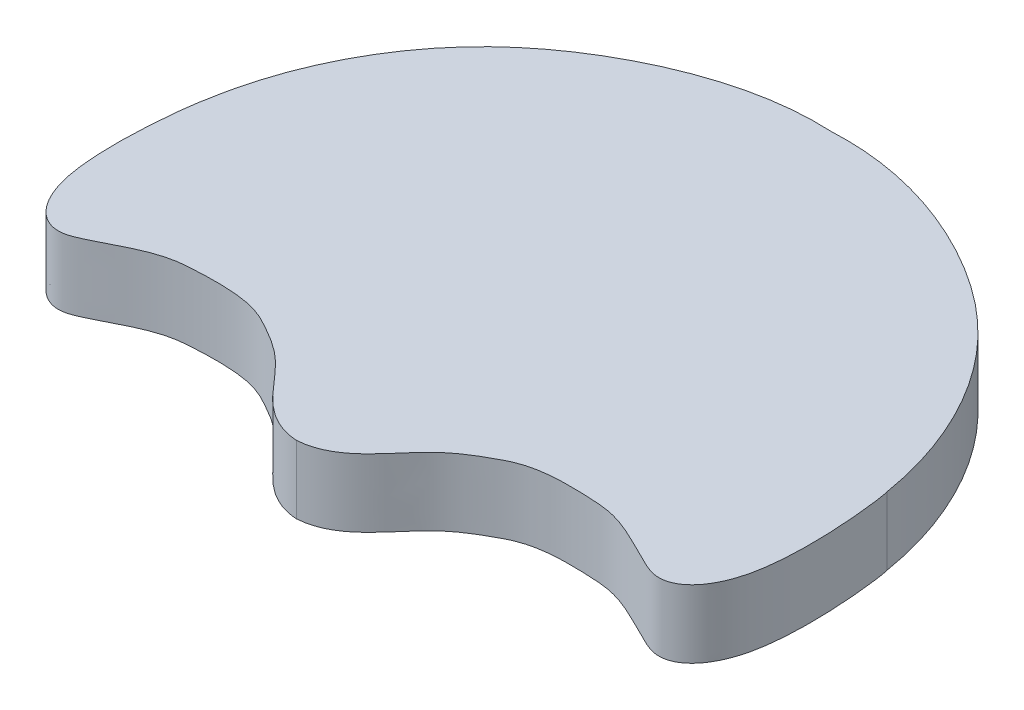
from build123d import *

# Parameters (mm, degrees)
BOSS_EXTRUDE1_DEPTH = 38.1


with BuildPart() as part:
    # Sketch3 → Boss-Extrude1 (new body)
    with BuildSketch(Plane(origin=(0, 0, 0), x_dir=(1, 0, 0), z_dir=(0, 1, 0))):
        with BuildLine():
            add(Edge.make_bspline(
                [(-190.5, 0), (-184.392726562, 37.537038237), (-157.261289847, 93.964093485), (-82.387478202, 146.622658841), (-31.311374143, 160.799884185), (0, 159.189909928)],
                knots=[0, 0, 0, 0, 0.424401366, 0.656369581, 1, 1, 1, 1], degree=3))
            add(Edge.make_bspline(
                [(190.5, 0), (184.392726562, 37.537038237), (157.261289847, 93.964093485), (82.387478202, 146.622658841), (31.311374143, 160.799884185), (0, 159.189909928)],
                knots=[0, 0, 0, 0, 0.424401366, 0.656369581, 1, 1, 1, 1], degree=3))
            add(Edge.make_bspline(
                [(190.5, 0), (192.064011793, -4.963501926), (201.967167766, -83.314618311), (174.696602041, -109.289958804), (151.630121659, -100.567984898), (131.410771519, -87.719783961), (96.843567628, -85.375403377), (78.692510144, -86.25882742), (58.833533072, -96.87938247), (37.30593461, -109.935798162), (21.349613946, -139.114767457), (0, -140.530090072)],
                knots=[0, 0, 0, 0, 0.166997052, 0.292320514, 0.319633117, 0.42673531, 0.45891405, 0.609241775, 0.641909704, 0.76680237, 1, 1, 1, 1], degree=3))
            add(Edge.make_bspline(
                [(-190.5, 0), (-192.064011793, -4.963501926), (-201.967167766, -83.314618311), (-174.696602041, -109.289958804), (-151.630121659, -100.567984898), (-131.410771519, -87.719783961), (-96.843567628, -85.375403377), (-78.692510144, -86.25882742), (-58.833533072, -96.87938247), (-37.30593461, -109.935798162), (-21.349613946, -139.114767457), (0, -140.530090072)],
                knots=[0, 0, 0, 0, 0.166997052, 0.292320514, 0.319633117, 0.42673531, 0.45891405, 0.609241775, 0.641909704, 0.76680237, 1, 1, 1, 1], degree=3))
        make_face()
    extrude(amount=BOSS_EXTRUDE1_DEPTH)


solid = part.part
